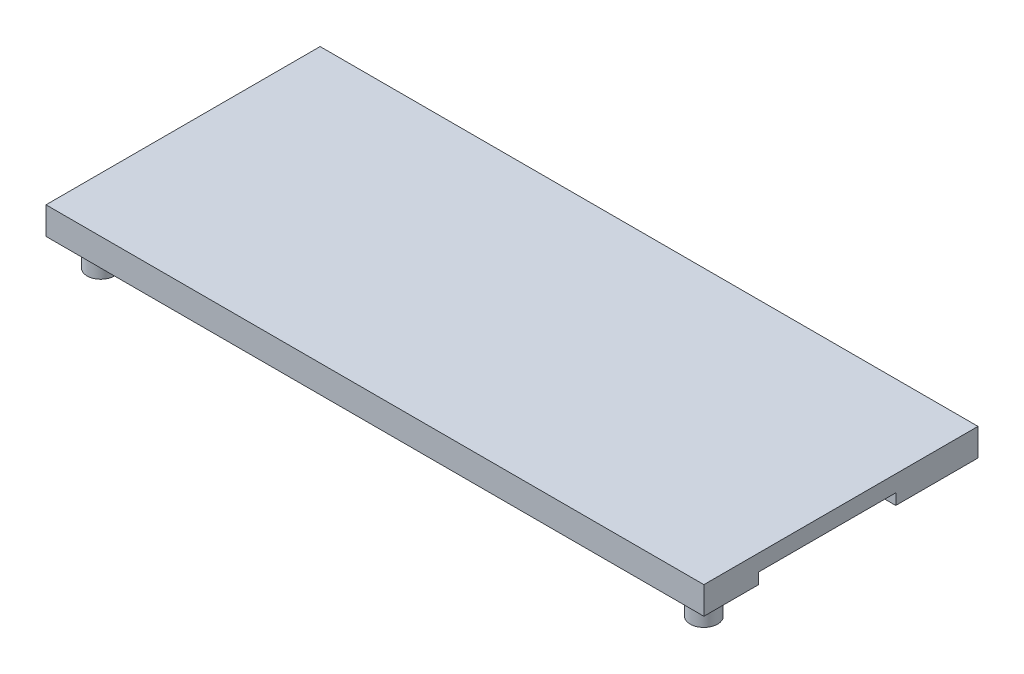
from build123d import *

# Parameters (mm, degrees)
SKETCH1_W               = 120
SKETCH1_H               = 50
BOSS_EXTRUDE1_DEPTH     = 5
CUT_EXTRUDE1_DEPTH      = 131.096118313
CUT_EXTRUDE1_DEPTH_BACK = 120
SKETCH2_W               = 25
SKETCH2_H               = 2
BOSS_EXTRUDE2_DEPTH     = 0.75
BOSS_EXTRUDE3_DEPTH     = 3.8
BOSS_EXTRUDE4_DEPTH     = 5.95
BOSS_EXTRUDE6_DEPTH     = 7.1
SKETCH10_R              = 2.5
BOSS_EXTRUDE7_DEPTH     = 5
BOSS_EXTRUDE8_DEPTH     = 25
SKETCH12_W              = 2.455775423
SKETCH12_H              = 2
BOSS_EXTRUDE9_DEPTH     = 25
FILLET1_R               = 4


with BuildPart() as part:
    # Sketch1 → Boss-Extrude1 (new body)
    with BuildSketch(Plane(origin=(0, 0, 0), x_dir=(1, 0, 0), z_dir=(0, 1, 0))):
        with Locations((8.146341463, 25)):
            Rectangle(SKETCH1_W, SKETCH1_H)
    extrude(amount=BOSS_EXTRUDE1_DEPTH)

    # Sketch2 → Cut-Extrude1 (cut, two sides: drawn at the far end of the back side and taken through both)
    with BuildSketch(Plane(origin=(68.146341463, 0, 0), x_dir=(0, 0, -1), z_dir=(1, 0, 0)).offset(-CUT_EXTRUDE1_DEPTH_BACK)):
        with Locations((22.5, 1)):
            Rectangle(SKETCH2_W, SKETCH2_H)
    extrude(amount=CUT_EXTRUDE1_DEPTH + CUT_EXTRUDE1_DEPTH_BACK, mode=Mode.SUBTRACT)

    # Sketch5 → Boss-Extrude2 (add)
    with BuildSketch(Plane(origin=(0, 0, -10), x_dir=(-1, 0, 0), z_dir=(0, 0, -1))):
        Polygon((-44.148415926, 0), (-46.148415926, 2), (-44.148415926, 2), align=None)
    extrude(amount=BOSS_EXTRUDE2_DEPTH)

    # Sketch6 → Boss-Extrude3 (add)
    with BuildSketch(Plane(origin=(0, 0, -10), x_dir=(-1, 0, 0), z_dir=(0, 0, -1))):
        Polygon((-20.178332659, 0), (-20.178332659, 2), (-22.178332659, 2), align=None)
    extrude(amount=BOSS_EXTRUDE3_DEPTH)

    # Sketch7 → Boss-Extrude4 (add)
    with BuildSketch(Plane(origin=(0, 0, -10), x_dir=(-1, 0, 0), z_dir=(0, 0, -1))):
        Polygon((3.853324248, 0), (3.853324248, 2), (1.853324248, 2), align=None)
    extrude(amount=BOSS_EXTRUDE4_DEPTH)

    # Sketch9 → Boss-Extrude6 (add)
    with BuildSketch(Plane(origin=(0, 0, -10), x_dir=(-1, 0, 0), z_dir=(0, 0, -1))):
        Polygon((27.849622994, 0), (27.853491393, 2), (25.853491393, 2), align=None)
    extrude(amount=BOSS_EXTRUDE6_DEPTH)

    # Sketch10 → Boss-Extrude7 (add)
    with BuildSketch(Plane.XZ):
        with Locations(Location((-46.853658537, -5, 0), (0, 0, 270))):
            Circle(SKETCH10_R)
        with Locations(Location((63.146341463, -5, 0), (0, 0, 270))):
            Circle(SKETCH10_R)
    extrude(amount=BOSS_EXTRUDE7_DEPTH)

    # Sketch11 → Boss-Extrude8 (add)
    with BuildSketch(Plane(origin=(0, 0, -10), x_dir=(-1, 0, 0), z_dir=(0, 0, -1))):
        Polygon((49.397883114, 0), (49.397883114, 2), (46.169924942, 2), align=None)
    extrude(amount=BOSS_EXTRUDE8_DEPTH)

    # Sketch12 → Boss-Extrude9 (add)
    with BuildSketch(Plane(origin=(0, 0, -10), x_dir=(-1, 0, 0), z_dir=(0, 0, -1))):
        with Locations((50.625770825, 1)):
            Rectangle(SKETCH12_W, SKETCH12_H)
    extrude(amount=BOSS_EXTRUDE9_DEPTH)

    # Fillet1
    fillet1_edges = [part.edges().sort_by_distance(p)[0] for p in [
        (-46.169924942, 2, -22.5),
        (46.148415926, 2, -10.375),
        (22.178332659, 2, -11.9),
        (-1.853324248, 2, -12.975),
        (-25.853491393, 2, -13.55),
    ]]
    fillet(fillet1_edges, radius=FILLET1_R)


solid = part.part
